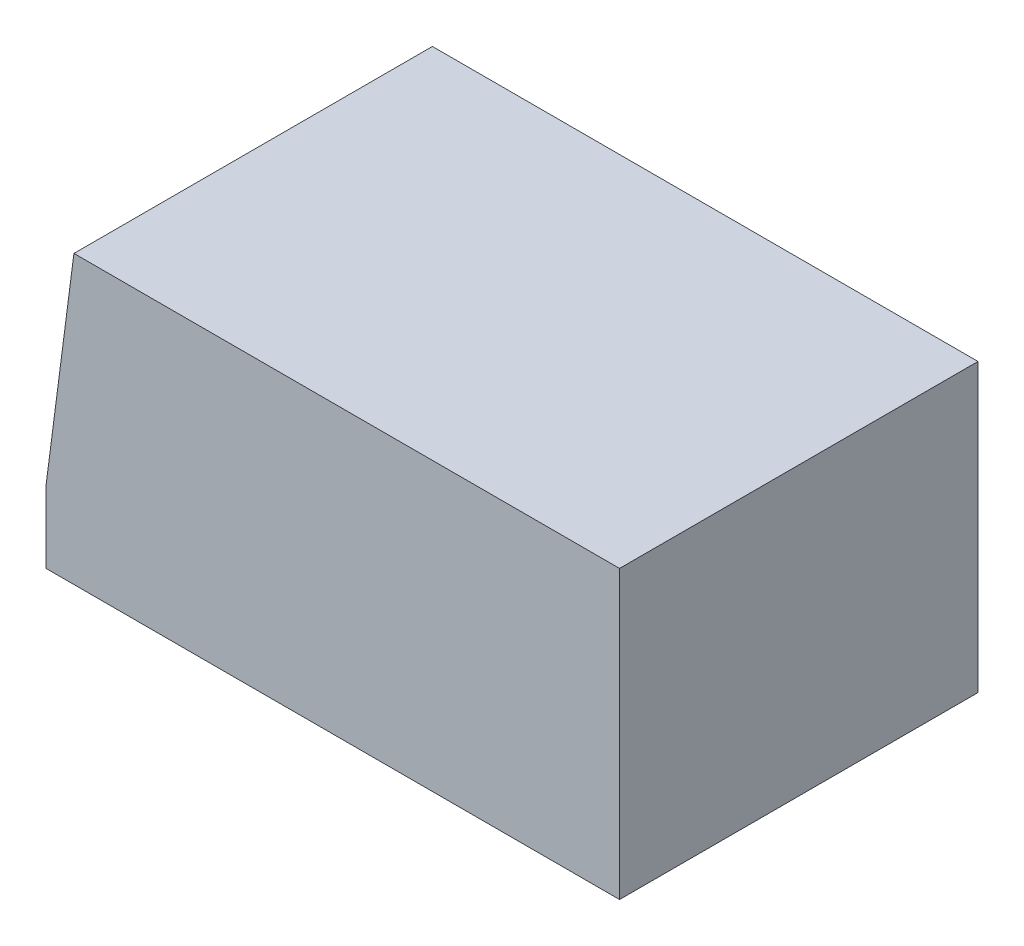
from build123d import *

# Parameters (mm, degrees)
ESQUISSE1_W             = 80
ESQUISSE1_H             = 50
BOSS_EXTRU_1_DEPTH      = 40
CHANFREIN1_SIZE         = 30
CHANFREIN1_SIZE2        = 3.896319712
ESQUISSE2_R             = 12.5
ENL_V_MAT_EXTRU_1_DEPTH = 40


with BuildPart() as part:
    # Esquisse1 → Boss.-Extru.1 (new body)
    with BuildSketch(Plane(origin=(0, 0, 0), x_dir=(1, 0, 0), z_dir=(0, 1, 0))):
        Rectangle(ESQUISSE1_W, ESQUISSE1_H)
    extrude(amount=BOSS_EXTRU_1_DEPTH)

    # Chanfrein1
    chanfrein1_edges = [part.edges().sort_by_distance(p)[0] for p in [
        (-40, 40, 0),
    ]]
    chanfrein1_side = [part.faces().sort_by_distance(p)[0] for p in [
        (-40, 20, 0),
    ]]
    chamfer(chanfrein1_edges, length=CHANFREIN1_SIZE, length2=CHANFREIN1_SIZE2, reference=chanfrein1_side[0])

    # Esquisse2 → Enlèv. mat.-Extru.1 (cut)
    with BuildSketch(Plane(origin=(-40.613696562, 5.274798216, 0), x_dir=(0, 0, 1), z_dir=(-0.9916711623830908, 0.12879559657755957, 0))):
        with Locations(Location((0, 18.821046558, 0), (0, 0, 270))):
            Circle(ESQUISSE2_R)
    extrude(amount=-ENL_V_MAT_EXTRU_1_DEPTH, mode=Mode.SUBTRACT)


solid = part.part
